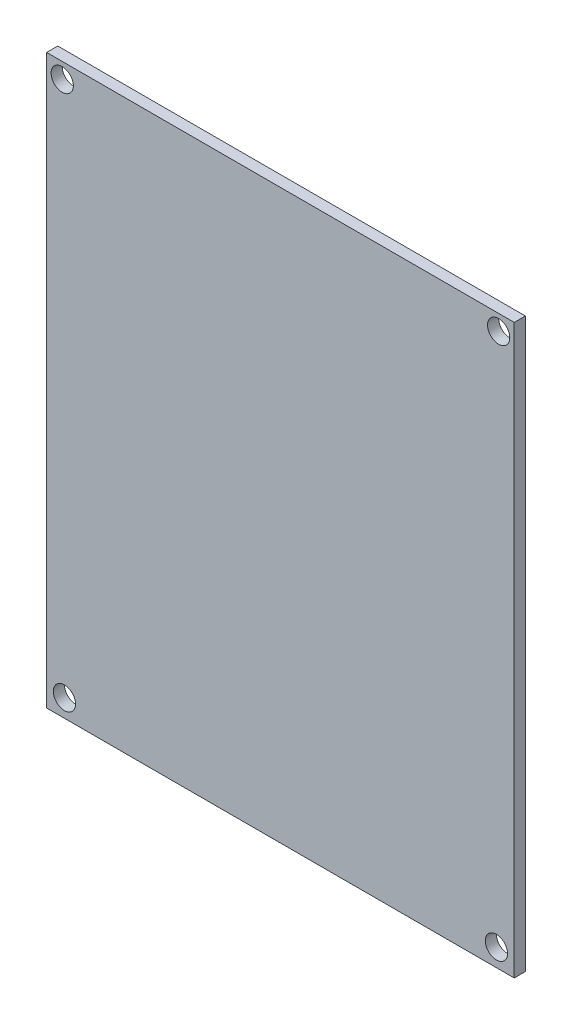
from build123d import *

# Parameters (mm, degrees)
CROQUIS1_W              = 210
CROQUIS1_H              = 255
CROQUIS1_R              = 5
SALIENTE_EXTRUIR1_DEPTH = 4.99999


with BuildPart() as part:
    # Croquis1 → Saliente-Extruir1 (new body)
    with BuildSketch(Plane.XY):
        with Locations((0, -189.715476502)):
            Rectangle(CROQUIS1_W, CROQUIS1_H)
        with Locations((-97, -309.215476502)):
            Circle(CROQUIS1_R, mode=Mode.SUBTRACT)
        with Locations((97, -309.215476502)):
            Circle(CROQUIS1_R, mode=Mode.SUBTRACT)
        with Locations((98, -69.215476502)):
            Circle(CROQUIS1_R, mode=Mode.SUBTRACT)
        with Locations((-98, -69.215476502)):
            Circle(CROQUIS1_R, mode=Mode.SUBTRACT)
    extrude(amount=SALIENTE_EXTRUIR1_DEPTH)


solid = part.part
